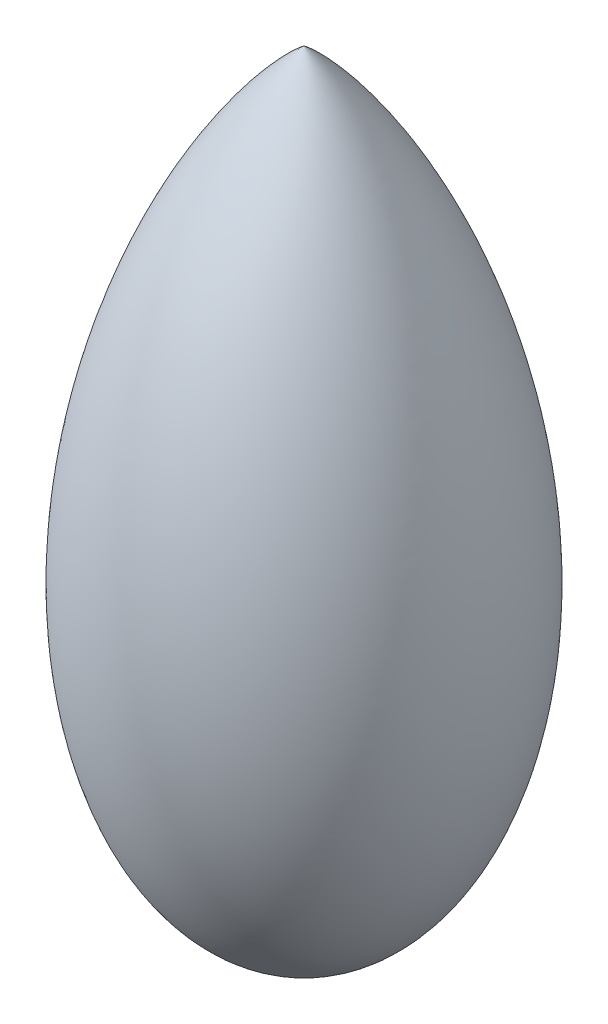
from build123d import *


with BuildPart() as part:
    # Sketch → Revolve 2 (revolve)
    with BuildSketch(Plane.XY):
        with BuildLine():
            Line((0, 0), (0, -397.88735773))
            add(Edge.make_bspline(
                [(0, 0), (0.075943118, -0.054918907), (0.226996678, -0.165878191), (0.525671323, -0.392426363), (1.115387865, -0.855424104), (1.985388, -1.567197151), (3.123381807, -2.541923368), (4.448842803, -3.728357624), (5.819195462, -5.003681886), (7.505036512, -6.62642776), (9.488561431, -8.614083647), (11.733666448, -10.964724434), (14.222459402, -13.693005756), (17.237624133, -17.137437978), (20.732158146, -21.336474858), (24.670356772, -26.347823719), (30.075973477, -33.674561648), (36.231715467, -42.703182638), (44.886805103, -56.625203983), (55.269121954, -75.868697219), (65.794358492, -99.11434862), (75.71426297, -126.535499635), (83.525608543, -154.629371503), (89.174926895, -183.237650127), (92.134761044, -208.583371905), (93.153511317, -230.424773429), (92.916574192, -248.637066331), (92.039846354, -263.182278757), (90.634475608, -275.855522597), (88.94226381, -286.651522466), (87.18807953, -295.585972248), (85.569957813, -302.688085155), (83.727959647, -309.735584111), (81.652057029, -316.717900074), (79.331297832, -323.622876862), (76.75368271, -330.436353023), (73.869644019, -337.227704026), (70.652715159, -343.971914028), (67.117762959, -350.555675948), (63.246569573, -356.948001018), (59.079176571, -363.039031311), (54.612861756, -368.797656253), (49.845199733, -374.177288752), (45.394978189, -378.533936735), (41.404562199, -381.968292233), (38.197929521, -384.440415498), (35.806800371, -386.142282186), (33.568506539, -387.618775276), (31.499784979, -388.889992928), (29.390009167, -390.091943787), (27.240408028, -391.221084751), (25.052277272, -392.273842316), (22.827555287, -393.246661374), (20.003061672, -394.358372911), (17.125107845, -395.325351157), (14.199378823, -396.139454655), (11.532343592, -396.728331741), (9.740704036, -397.059490697), (8.243268814, -397.293864905), (7.03680047, -397.456186465), (5.83720991, -397.593127934), (4.616945744, -397.704522119), (3.425800823, -397.790228455), (2.178167955, -397.850140102), (1.231626925, -397.878338216), (0.455246439, -397.886468376), (0.087650456, -397.88735773), (0, -397.88735773)],
                knots=[0, 0, 0, 0, 0, 0.000742843, 0.001485686, 0.002971372, 0.005942744, 0.009652185, 0.013361626, 0.017071067, 0.020780507, 0.028199389, 0.035618271, 0.042834462, 0.050050653, 0.064483035, 0.078915417, 0.0933478, 0.122212529, 0.151077259, 0.208806785, 0.266536285, 0.324265833, 0.381995382, 0.439724932, 0.497454464, 0.526319246, 0.555184029, 0.584048756, 0.612913484, 0.627345883, 0.641778281, 0.65621068, 0.670643078, 0.685075423, 0.699507768, 0.713940112, 0.728372457, 0.743544526, 0.758716595, 0.773148895, 0.787581195, 0.802013503, 0.816445812, 0.830083071, 0.836901701, 0.84372033, 0.848531147, 0.853341965, 0.858152782, 0.862963599, 0.867774379, 0.872585158, 0.877395938, 0.882206717, 0.891828245, 0.896639009, 0.901449773, 0.903855158, 0.906260543, 0.908665928, 0.911071314, 0.913476699, 0.915882084, 0.918287469, 0.920692854, 0.921446859, 0.921446859, 0.921446859, 0.921446859, 0.921446859], degree=4))
        make_face()
    revolve(axis=Axis((0, 0, 0), (0, -1, 0)))


solid = part.part
